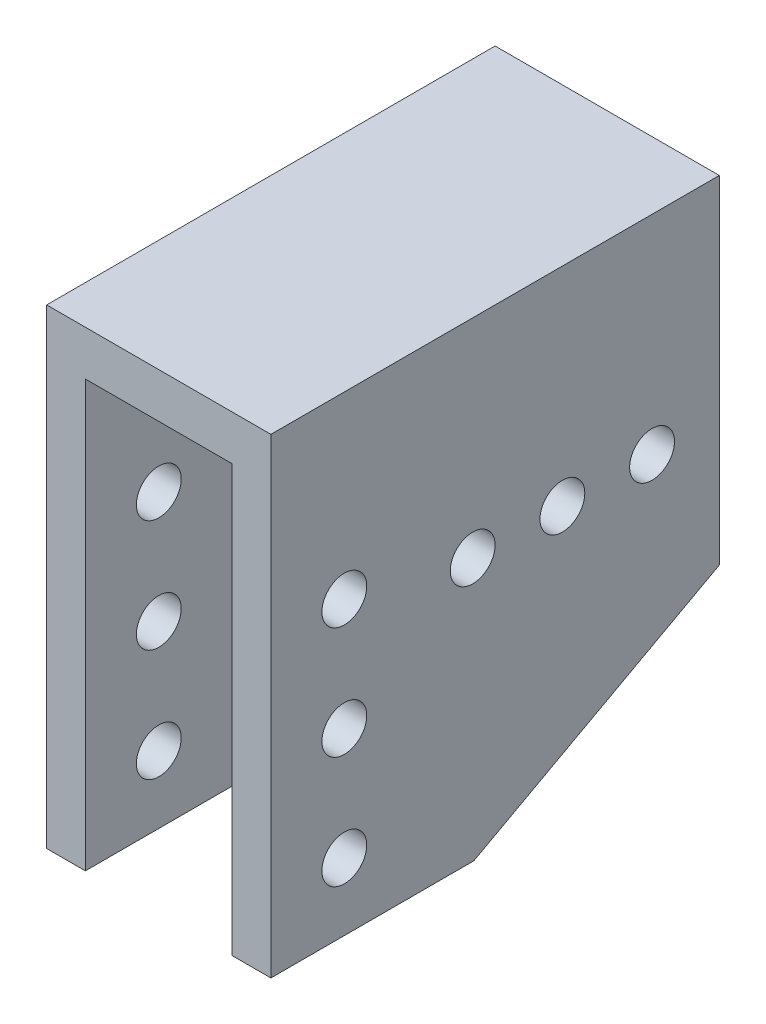
from build123d import *

# Parameters (mm, degrees)
SKETCH1_W               = 20
SKETCH1_H               = 40
BOSS_EXTRUDE1_DEPTH     = 20
SKETCH2_W               = 13.1
SKETCH2_H               = 13.1
CUT_EXTRUDE1_DEPTH      = 49.989794856
SKETCH3_W               = 13.1
SKETCH3_H               = 13.1
CUT_EXTRUDE2_DEPTH      = 40.033447196
BOSS_EXTRUDE2_DEPTH     = 10
SKETCH5_W               = 20
SKETCH5_H               = 40
BOSS_EXTRUDE3_DEPTH     = 12
SKETCH6_W               = 13.1
SKETCH6_H               = 8
CUT_EXTRUDE3_DEPTH      = 13.1
SKETCH7_R               = 2
CUT_EXTRUDE4_DEPTH      = 55.990908339
CUT_EXTRUDE5_DEPTH      = 54.83216975
CUT_EXTRUDE5_DEPTH_BACK = 54.83216975
SKETCH8_R               = 2
CUT_EXTRUDE6_DEPTH      = 55.990908339


with BuildPart() as part:
    # Sketch1 → Boss-Extrude1 (new body)
    with BuildSketch(Plane(origin=(0, 0, 0), x_dir=(1, 0, 0), z_dir=(0, 1, 0))):
        with Locations((10, 20)):
            Rectangle(SKETCH1_W, SKETCH1_H)
    extrude(amount=BOSS_EXTRUDE1_DEPTH)

    # Sketch2 → Cut-Extrude1 (cut, through all)
    with BuildSketch(Plane(origin=(0, 20, 0), x_dir=(1, 0, 0), z_dir=(0, 1, 0))):
        with Locations((10, 6.55)):
            Rectangle(SKETCH2_W, SKETCH2_H)
    extrude(amount=-CUT_EXTRUDE1_DEPTH, mode=Mode.SUBTRACT)

    # Sketch3 → Cut-Extrude2 (cut, through all)
    with BuildSketch(Plane.XY.offset(-13.1)):
        with Locations((10, 13.45)):
            Rectangle(SKETCH3_W, SKETCH3_H)
    extrude(amount=-CUT_EXTRUDE2_DEPTH, mode=Mode.SUBTRACT)

    # Sketch4 → Boss-Extrude2 (add)
    with BuildSketch(Plane.XZ):
        Polygon((3.45, -13.1), (3.45, 0), (0, 0), (0, -40), (20, -40), (20, 0), (16.55, 0), (16.55, -13.1), align=None)
    extrude(amount=BOSS_EXTRUDE2_DEPTH)

    # Sketch5 → Boss-Extrude3 (add)
    with BuildSketch(Plane(origin=(0, 20, 0), x_dir=(1, 0, 0), z_dir=(0, 1, 0))):
        with Locations((10, 20)):
            Rectangle(SKETCH5_W, SKETCH5_H)
    extrude(amount=BOSS_EXTRUDE3_DEPTH)

    # Sketch6 → Cut-Extrude3 (cut)
    with BuildSketch(Plane.XY):
        with Locations((10, 24)):
            Rectangle(SKETCH6_W, SKETCH6_H)
    extrude(amount=-CUT_EXTRUDE3_DEPTH, mode=Mode.SUBTRACT)

    # Sketch7 → Cut-Extrude4 (cut, through all)
    with BuildSketch(Plane(origin=(20, 0, 0), x_dir=(0, 0, -1), z_dir=(1, 0, 0))):
        with Locations((6.55, -4)):
            Circle(SKETCH7_R)
        with Locations((6.55, 16)):
            Circle(SKETCH7_R)
        with Locations((6.55, 6)):
            Circle(SKETCH7_R)
    extrude(amount=-CUT_EXTRUDE4_DEPTH, mode=Mode.SUBTRACT)

    # Sketch8 → Cut-Extrude5 (cut, two sides: drawn at the far end of the back side and taken through both)
    with BuildSketch(Plane(origin=(3.45, 0, 0), x_dir=(0, 0, -1), z_dir=(1, 0, 0)).offset(-CUT_EXTRUDE5_DEPTH_BACK)):
        with Locations((34, 13.45)):
            Circle(SKETCH8_R)
        with Locations((26, 13.45)):
            Circle(SKETCH8_R)
        with Locations((18, 13.45)):
            Circle(SKETCH8_R)
    extrude(amount=CUT_EXTRUDE5_DEPTH + CUT_EXTRUDE5_DEPTH_BACK, mode=Mode.SUBTRACT)

    # Sketch9 → Cut-Extrude6 (cut, through all)
    with BuildSketch(Plane(origin=(20, 0, 0), x_dir=(0, 0, -1), z_dir=(1, 0, 0))):
        Polygon((18.1, -10), (40, -10), (40, 1.9), align=None)
    extrude(amount=-CUT_EXTRUDE6_DEPTH, mode=Mode.SUBTRACT)


solid = part.part
